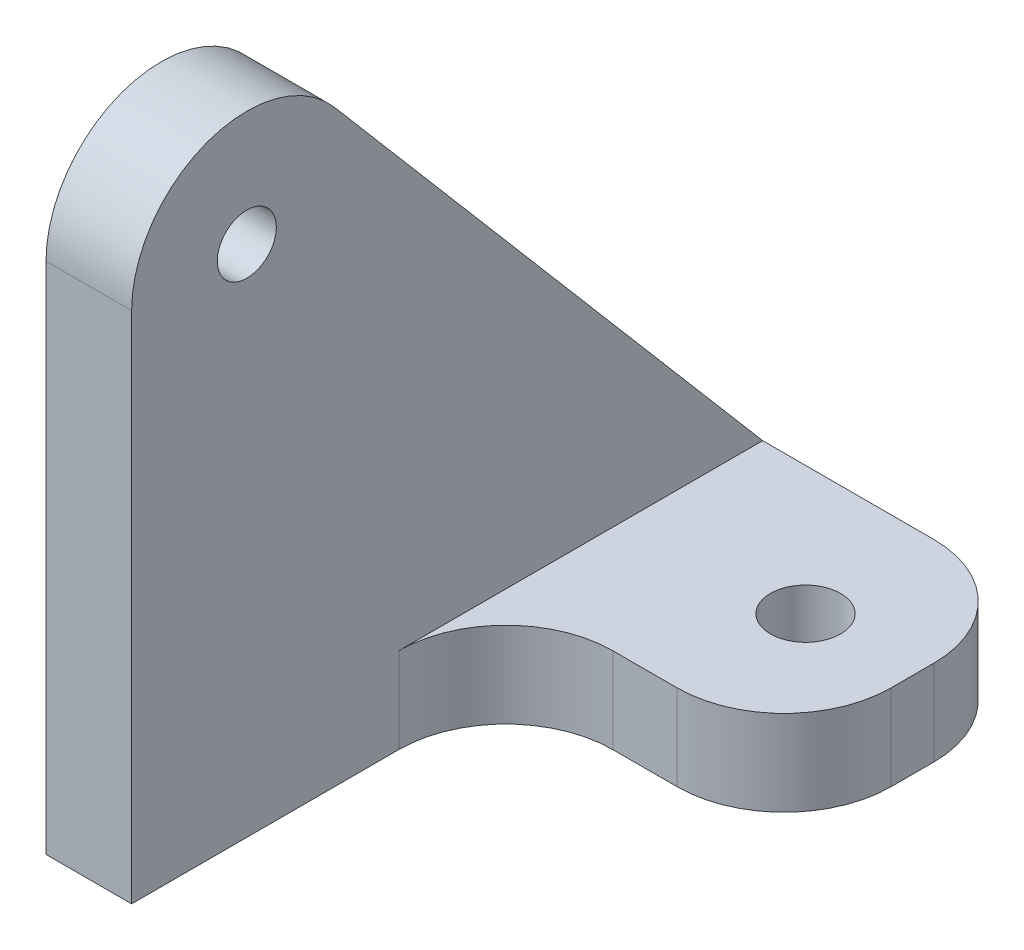
from build123d import *

# Parameters (mm, degrees)
SKETCH1_R           = 2.0828
BOSS_EXTRUDE1_DEPTH = 5.08
SKETCH2_R           = 1.7526
BOSS_EXTRUDE2_DEPTH = 2.54
FILLET1_R           = 6.35


with BuildPart() as part:
    # Sketch1 → Boss-Extrude1 (new body)
    with BuildSketch(Plane(origin=(0, 0, 0), x_dir=(1, 0, 0), z_dir=(0, 1, 0))):
        with BuildLine():
            Line((-12.7, -7.62), (12.7, -7.62))
            ThreePointArc((12.7, -7.62), (17.190128061, -5.760128061), (19.05, -1.27))
            Line((19.05, -1.27), (19.05, 1.27))
            ThreePointArc((19.05, 1.27), (17.190128061, 5.760128061), (12.7, 7.62))
            Line((12.7, 7.62), (-12.7, 7.62))
            ThreePointArc((-12.7, 7.62), (-17.190128061, 5.760128061), (-19.05, 1.27))
            Line((-19.05, 1.27), (-19.05, -1.27))
            ThreePointArc((-19.05, -1.27), (-17.190128061, -5.760128061), (-12.7, -7.62))
        make_face()
        with Locations(Location((-12.7, 0, 0), (0, 0, 270))):
            Circle(SKETCH1_R, mode=Mode.SUBTRACT)
        with Locations(Location((12.7, 0, 0), (0, 0, 270))):
            Circle(SKETCH1_R, mode=Mode.SUBTRACT)
    extrude(amount=BOSS_EXTRUDE1_DEPTH)

    # Sketch2 → Boss-Extrude2 (add, symmetric)
    with BuildSketch(Plane(origin=(0, 0, 0), x_dir=(0, 0, -1), z_dir=(1, 0, 0))):
        with BuildLine():
            Line((7.62, 5.08), (-17.785245966, 34.910144211))
            ThreePointArc((-17.785245966, 34.910144211), (-25.347393839, 36.891939152), (-29.8196, 30.48))
            Line((-29.8196, 30.48), (-29.8196, 0))
            Line((-29.8196, 0), (7.62, 0))
            Line((7.62, 0), (7.62, 5.08))
        make_face()
        with Locations((-22.987, 30.48)):
            Circle(SKETCH2_R, mode=Mode.SUBTRACT)
    extrude(amount=BOSS_EXTRUDE2_DEPTH, both=True)

    # Fillet1
    fillet1_edges = [part.edges().sort_by_distance(p)[0] for p in [
        (-2.54, 2.54, 7.62),
        (2.54, 2.54, 7.62),
    ]]
    fillet(fillet1_edges, radius=FILLET1_R)


solid = part.part
